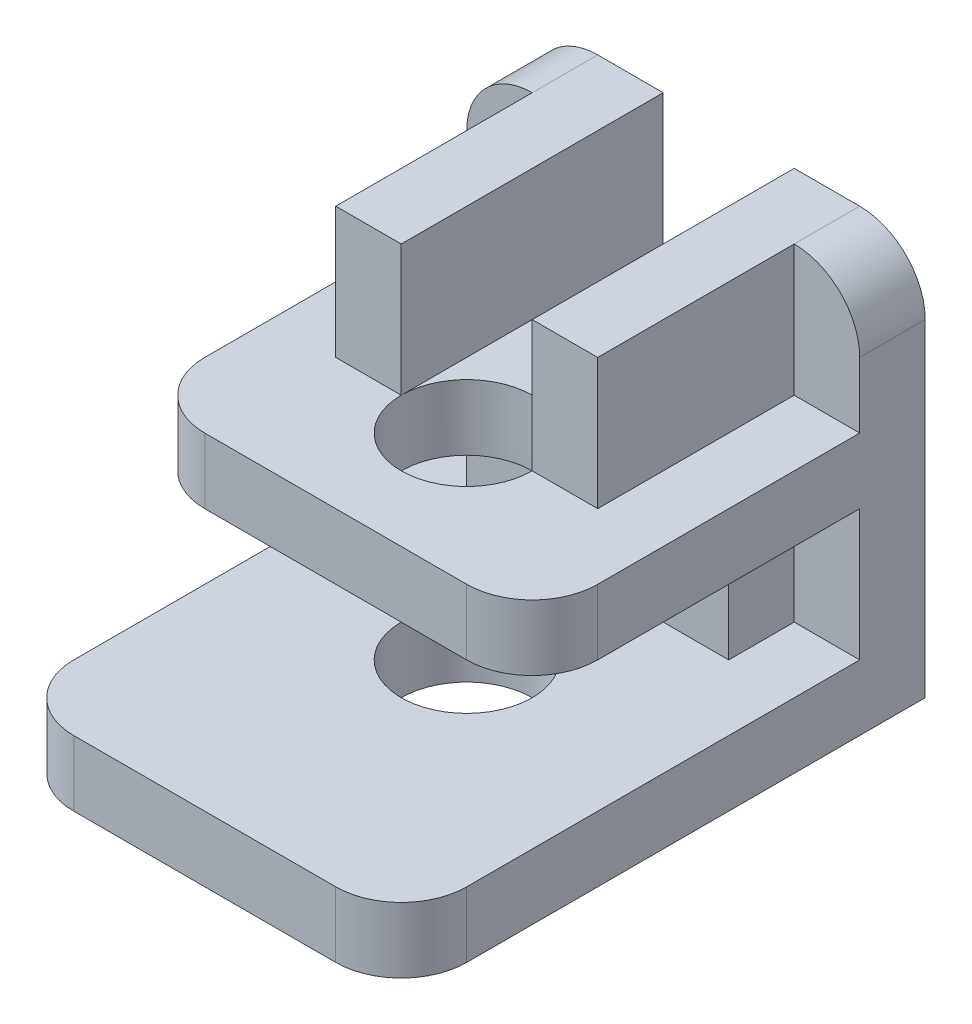
from build123d import *

# Parameters (mm, degrees)
SKETCH_1_W               = 60
SKETCH_1_H               = 80
EXTRUDE_1_DEPTH          = 10
SKETCH_2_W               = 60
SKETCH_2_H               = 10
EXTRUDE_2_DEPTH          = 50
SKETCH_3_W               = 60
SKETCH_3_H               = 10
EXTRUDE_3_DEPTH          = 50
SKETCH_4_W               = 40
SKETCH_4_H               = 20
EXTRUDE_4_DEPTH          = 10
SKETCH_5_W               = 40
SKETCH_5_H               = 20
EXTRUDE_5_DEPTH          = 30
SKETCH_6_W               = 20
SKETCH_6_H               = 20
CUT_EXTRUDE_1_DEPTH      = 50
FILLET_1_R               = 10
CUT_EXTRUDE_2_DEPTH      = 50
CUT_EXTRUDE_2_DEPTH_BACK = 50
SKETCH_7_R               = 10


with BuildPart() as part:
    # 스케치1 → 보스-돌출1 (new body)
    with BuildSketch(Plane(origin=(0, 0, 0), x_dir=(1, 0, 0), z_dir=(0, 1, 0))):
        with Locations((30, 40)):
            Rectangle(SKETCH_1_W, SKETCH_1_H)
    extrude(amount=EXTRUDE_1_DEPTH)

    # 스케치2 → 보스-돌출2 (add)
    with BuildSketch(Plane(origin=(0, 10, 0), x_dir=(1, 0, 0), z_dir=(0, 1, 0))):
        with Locations((30, 75)):
            Rectangle(SKETCH_2_W, SKETCH_2_H)
    extrude(amount=EXTRUDE_2_DEPTH)

    # 스케치3 → 보스-돌출3 (add)
    with BuildSketch(Plane.XY.offset(-70)):
        with Locations((30, 35)):
            Rectangle(SKETCH_3_W, SKETCH_3_H)
    extrude(amount=EXTRUDE_3_DEPTH)

    # 스케치4 → 보스-돌출4 (add)
    with BuildSketch(Plane.XY.offset(-70)):
        with Locations((30, 20)):
            Rectangle(SKETCH_4_W, SKETCH_4_H)
    extrude(amount=EXTRUDE_4_DEPTH)

    # 스케치5 → 보스-돌출5 (add)
    with BuildSketch(Plane.XY.offset(-70)):
        with Locations((30, 50)):
            Rectangle(SKETCH_5_W, SKETCH_5_H)
    extrude(amount=EXTRUDE_5_DEPTH)

    # 스케치6 → 컷-돌출1 (cut)
    with BuildSketch(Plane.XY.offset(-40)):
        with Locations((30, 50)):
            Rectangle(SKETCH_6_W, SKETCH_6_H)
    extrude(amount=-CUT_EXTRUDE_1_DEPTH, mode=Mode.SUBTRACT)

    # 필렛1
    fillet_1_edges = [part.edges().sort_by_distance(p)[0] for p in [
        (0, 60, -75),
        (60, 60, -75),
        (0, 35, -20),
        (60, 35, -20),
        (60, 5, 0),
        (0, 5, 0),
    ]]
    fillet(fillet_1_edges, radius=FILLET_1_R)

    # 스케치7 → 컷-돌출2 (cut, two sides: drawn at the far end of the back side and taken through both)
    with BuildSketch(Plane(origin=(0, 10, 0), x_dir=(1, 0, 0), z_dir=(0, 1, 0)).offset(-CUT_EXTRUDE_2_DEPTH_BACK)):
        with Locations(Location((30, 40, 0), (0, 0, 90))):
            Circle(SKETCH_7_R)
    extrude(amount=CUT_EXTRUDE_2_DEPTH + CUT_EXTRUDE_2_DEPTH_BACK, mode=Mode.SUBTRACT)


solid = part.part
